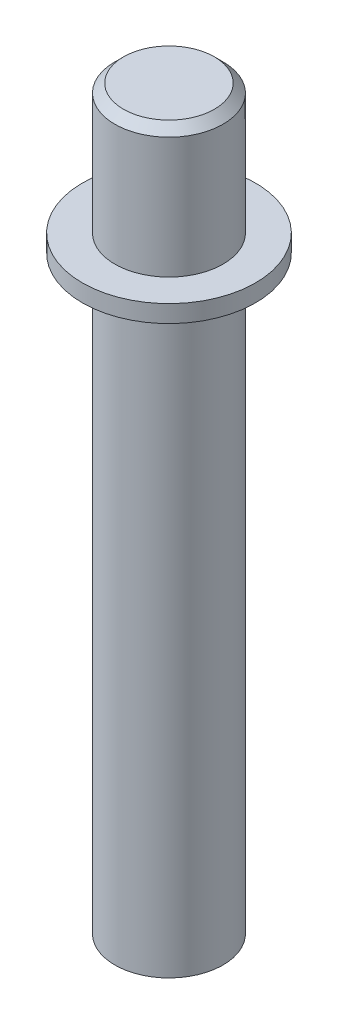
from build123d import *

# Parameters (mm, degrees)
SKETCH1_R           = 3.175
BOSS_EXTRUDE1_DEPTH = 14.2875
SKETCH3_R           = 5.08
BOSS_EXTRUDE2_DEPTH = 1.016
SKETCH4_R           = 3.175
BOSS_EXTRUDE3_DEPTH = 7.62
CHAMFER2_SIZE       = 0.508
BOSS_EXTRUDE4_START = 20.32
SKETCH9_R           = 3.175
BOSS_EXTRUDE4_DEPTH = 20.32


with BuildPart() as part:
    # Sketch1 → Boss-Extrude1 (new body)
    with BuildSketch(Plane(origin=(0, 0, 0), x_dir=(1, 0, 0), z_dir=(0, 1, 0))):
        with Locations(Location((0, 0, 0), (0, 0, 270))):
            Circle(SKETCH1_R)
    extrude(amount=BOSS_EXTRUDE1_DEPTH)

    # Sketch3 → Boss-Extrude2 (add)
    with BuildSketch(Plane(origin=(0, 14.2875, 0), x_dir=(1, 0, 0), z_dir=(0, 1, 0))):
        with Locations(Location((0, 0, 0), (0, 0, 270))):
            Circle(SKETCH3_R)
    extrude(amount=BOSS_EXTRUDE2_DEPTH)

    # Sketch4 → Boss-Extrude3 (add)
    with BuildSketch(Plane(origin=(0, 15.3035, 0), x_dir=(1, 0, 0), z_dir=(0, 1, 0))):
        with Locations(Location((0, 0, 0), (0, 0, 270))):
            Circle(SKETCH4_R)
    extrude(amount=BOSS_EXTRUDE3_DEPTH)

    # Chamfer2
    chamfer2_edges = [part.edges().sort_by_distance(p)[0] for p in [
        (0, 22.9235, -3.175),
    ]]
    chamfer(chamfer2_edges, length=CHAMFER2_SIZE)

    # Sketch9 → Boss-Extrude4 (add)
    with BuildSketch(Plane.XZ.offset(BOSS_EXTRUDE4_START)):
        with Locations(Location((0, 0, 0), (0, 0, 270))):
            Circle(SKETCH9_R)
    extrude(amount=-BOSS_EXTRUDE4_DEPTH)


solid = part.part
